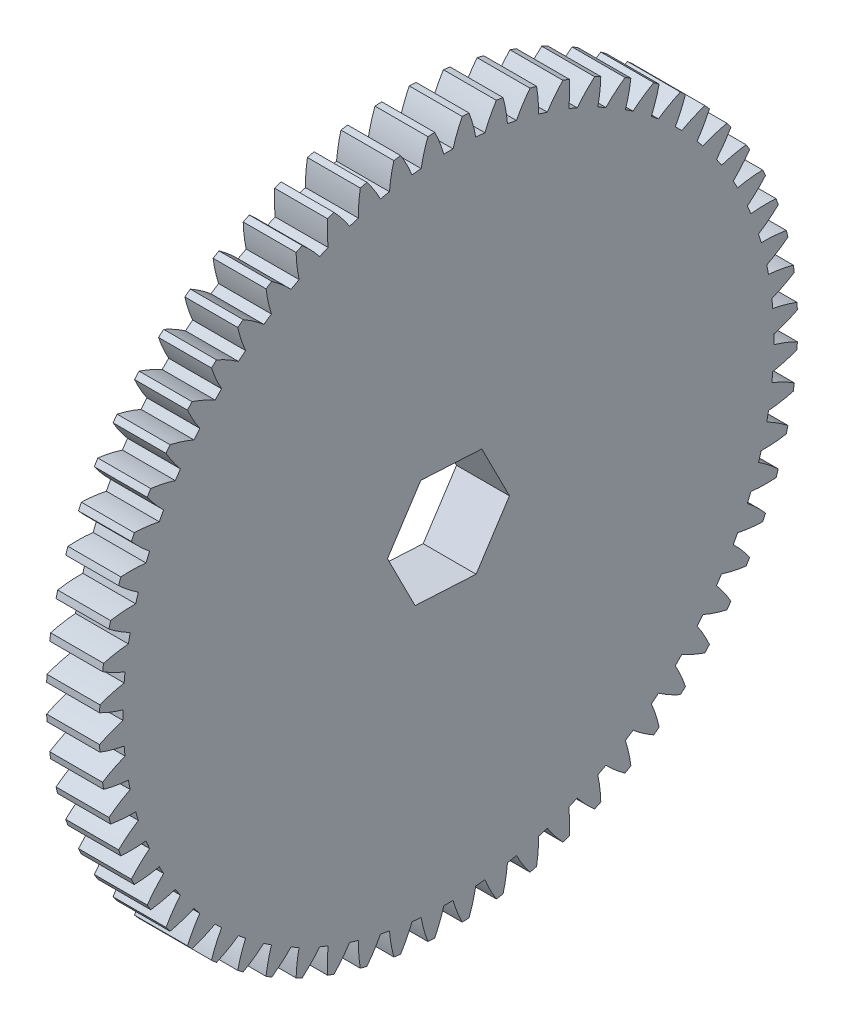
from build123d import *

# Parameters (mm, degrees)
BASPROSKE_W        = 6.35
BASPROSKE_H        = 41.91
TOOTHCUT_DEPTH     = 60.60888105
TEETHCUTS_COUNT    = 64
TEETHCUTS_ANGLE    = 354.375
HUBNEABOTSKE_R     = 1.27
HUBNEARBOTH_DEPTH  = 22.2250254
HUBFAR_START       = 22.2250254
HUBFARSKE_R        = 1.27
HUBFAR_DEPTH       = 22.2250254
BORSKE_R           = 6.35
BORE_DEPTH         = 50.8000508
CUT_EXTRUDE1_DEPTH = 60.563237399


with BuildPart() as part:
    # BasProSke → Base-Revolve (revolve)
    with BuildSketch(Plane(origin=(0, 0, 0), x_dir=(1, 0, 0), z_dir=(0, 1, 0)), mode=Mode.PRIVATE) as base_revolve_sk:
        with Locations((3.175, 20.955)):
            Rectangle(BASPROSKE_W, BASPROSKE_H)
    revolve(base_revolve_sk.sketch.rotate(Axis((-10, 0, 0), (1, 0, 0)), 180), axis=Axis((-10, 0, 0), (1, 0, 0)))

    # TooCutSke → ToothCut (cut, through all)
    with BuildSketch(Plane(origin=(0, 0, 0), x_dir=(0, 0, -1), z_dir=(1, 0, 0))):
        with BuildLine():
            ThreePointArc((0.551518867, 39.06130666), (0, 39.0652), (-0.551518867, 39.06130666))
            ThreePointArc((-0.551518867, 39.06130666), (-1.039812312, 40.507982989), (-1.661682415, 41.902465139))
            ThreePointArc((-1.661682415, 41.902465139), (0, 41.9354), (1.661682415, 41.902465139))
            ThreePointArc((1.661682415, 41.902465139), (1.039812312, 40.507982989), (0.551518867, 39.06130666))
        make_face()
    toothcut = extrude(amount=TOOTHCUT_DEPTH, mode=Mode.SUBTRACT)

    # TeethCuts: ToothCut ×64 about axis
    teethcuts_axis = Axis((-10, 0, 0), (1, 0, 0))
    for i in range(1, TEETHCUTS_COUNT):
        add(toothcut.rotate(teethcuts_axis, i * TEETHCUTS_ANGLE / (TEETHCUTS_COUNT - 1)), mode=Mode.SUBTRACT)

    # HubNeaBotSke → HubNearBoth (add)
    with BuildSketch(Plane.ZY):
        with Locations(Location((0, 0, 0), (0, 0, 180))):
            Circle(HUBNEABOTSKE_R)
    extrude(amount=HUBNEARBOTH_DEPTH)

    # HubFarSke → HubFar (add)
    with BuildSketch(Plane(origin=(6.35, 0, 0), x_dir=(0, 0, -1), z_dir=(1, 0, 0)).offset(HUBFAR_START)):
        Circle(HUBFARSKE_R)
    extrude(amount=-HUBFAR_DEPTH)

    # BorSke → Bore (cut, symmetric)
    with BuildSketch(Plane(origin=(0, 0, 0), x_dir=(0, 0, -1), z_dir=(1, 0, 0))):
        with Locations(Location((0, 0, 0), (0, 0, 180))):
            Circle(BORSKE_R)
    extrude(amount=BORE_DEPTH, both=True, mode=Mode.SUBTRACT)

    # Sketch1 → Cut-Extrude1 (cut, through all)
    with BuildSketch(Plane(origin=(6.35, 0, 0), x_dir=(0, 0, -1), z_dir=(1, 0, 0))):
        Polygon((4.003752529, 6.142743607), (-3.317895748, 6.538723204), (-7.321648277, 0.395979598), (-4.003752529, -6.142743607), (3.317895748, -6.538723204), (7.321648277, -0.395979598), align=None)
    extrude(amount=-CUT_EXTRUDE1_DEPTH, mode=Mode.SUBTRACT)


solid = part.part
